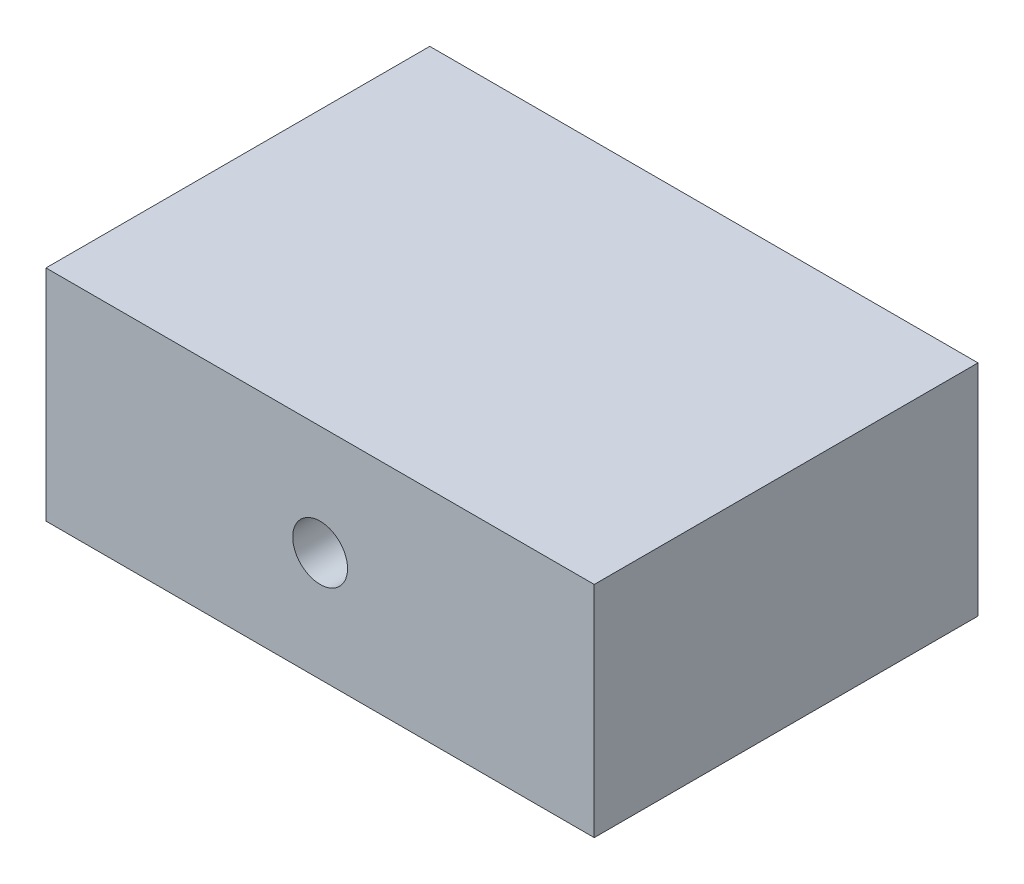
from build123d import *

# Parameters (mm, degrees)
SKETCH1_W           = 500
SKETCH1_H           = 200
SKETCH1_R           = 25
BOSS_EXTRUDE1_DEPTH = 350


with BuildPart() as part:
    # Sketch1 → Boss-Extrude1 (new body)
    with BuildSketch(Plane.XY):
        Rectangle(SKETCH1_W, SKETCH1_H)
        Circle(SKETCH1_R, mode=Mode.SUBTRACT)
    extrude(amount=BOSS_EXTRUDE1_DEPTH)


solid = part.part
